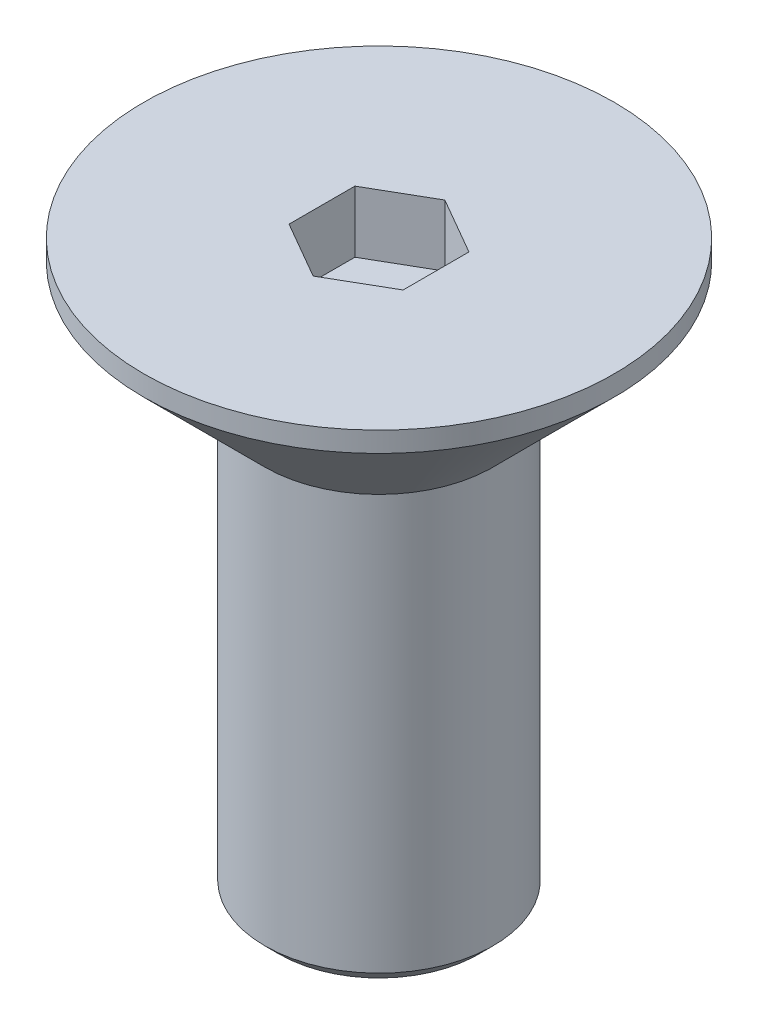
from build123d import *

# Parameters (mm, degrees)
CUT_EXTRUDE1_DEPTH = 2.16
CHAMFER1_SIZE      = 0.5


with BuildPart() as part:
    # Sketch2 → Revolve1 (revolve)
    with BuildSketch(Plane.XY, mode=Mode.PRIVATE) as revolve1_sk:
        Polygon((0, 0), (8.25, 0), (8.25, -0.71), (4, -4.96), (4, -20), (0, -20), align=None)
    revolve(revolve1_sk.sketch.rotate(Axis((0, 0, 0), (0, -1, 0)), 90), axis=Axis((0, 0, 0), (0, -1, 0)))

    # Sketch3 → Cut-Extrude1 (cut)
    with BuildSketch(Plane(origin=(0, 0, 0), x_dir=(1, 0, 0), z_dir=(0, 1, 0))):
        Polygon((0, 2.309401077), (2, 1.154700538), (2, -1.154700538), (0, -2.309401077), (-2, -1.154700538), (-2, 1.154700538), align=None)
    extrude(amount=-CUT_EXTRUDE1_DEPTH, mode=Mode.SUBTRACT)

    # Chamfer1
    chamfer1_edges = [part.edges().sort_by_distance(p)[0] for p in [
        (0, -20, -4),
    ]]
    chamfer(chamfer1_edges, length=CHAMFER1_SIZE)


solid = part.part
